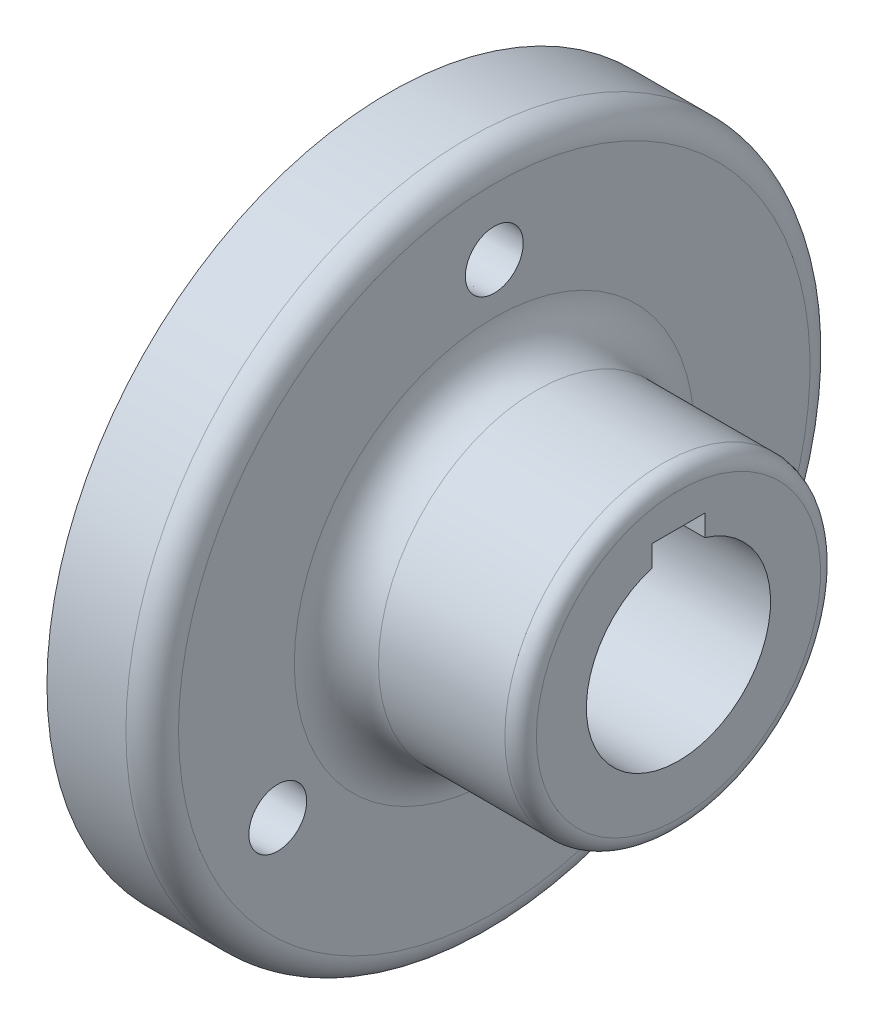
from build123d import *

# Parameters (mm, degrees)
SKETCH2_R          = 17.5
CUT_EXTRUDE1_DEPTH = 108.121426428
SKETCH3_W          = 10
SKETCH3_H          = 6.6
CUT_EXTRUDE2_DEPTH = 108.121426428
SKETCH4_R          = 4
CUT_EXTRUDE3_DEPTH = 10
SKETCH6_R          = 81.550028755
CUT_EXTRUDE6_DEPTH = 60


with BuildPart() as part:
    # Sketch1 → Revolve1 (revolve)
    with BuildSketch(Plane.XY, mode=Mode.PRIVATE) as revolve1_sk:
        with BuildLine():
            Line((-55, 0), (0, 0))
            Line((0, 0), (0, 65))
            Line((0, 65), (-15, 65))
            ThreePointArc((-15, 65), (-18.535533906, 63.535533906), (-20, 60))
            Line((-20, 60), (-20, 38))
            ThreePointArc((-20, 38), (-22.343145751, 32.343145751), (-28, 30))
            Line((-28, 30), (-52, 30))
            ThreePointArc((-52, 30), (-54.121320344, 29.121320344), (-55, 27))
            Line((-55, 27), (-55, 0))
        make_face()
    revolve(revolve1_sk.sketch.rotate(Axis((-55, 0, 0), (1, 0, 0)), 90), axis=Axis((-55, 0, 0), (1, 0, 0)))

    # Sketch2 → Cut-Extrude1 (cut, through all)
    with BuildSketch(Plane.ZY.offset(55)):
        Circle(SKETCH2_R)
    extrude(amount=-CUT_EXTRUDE1_DEPTH, mode=Mode.SUBTRACT)

    # Sketch3 → Cut-Extrude2 (cut, through all)
    with BuildSketch(Plane(origin=(0, 0, 0), x_dir=(0, 0, -1), z_dir=(1, 0, 0))):
        with Locations((0, 17.5)):
            Rectangle(SKETCH3_W, SKETCH3_H)
    extrude(amount=-CUT_EXTRUDE2_DEPTH, mode=Mode.SUBTRACT)

    # Sketch4 → Cut-Extrude3 (cut)
    with BuildSketch(Plane(origin=(0, -30, 0), x_dir=(-1, 0, 0), z_dir=(0, -1, 0))):
        with Locations(Location((40.229772479, 0, 0), (0, 0, 90))):
            Circle(SKETCH4_R)
    extrude(amount=-CUT_EXTRUDE3_DEPTH, mode=Mode.SUBTRACT)

    # Cut-Extrude5 cone 1 section (through the dimple's axis) → Cut-Extrude5 (revolve, cut)
    with BuildSketch(Plane(origin=(0, 47.5, 0), x_dir=(0, 0, -1), z_dir=(0, 1, 0))):
        Polygon((0, 0), (7, 0), (0, 93.336682434), align=None)
    revolve(axis=Axis((0, 47.5, 0), (-1, 0, 0)), mode=Mode.SUBTRACT)

    # Cut-Extrude5 cone 2 section (through the dimple's axis) → Cut-Extrude5 cone 2 (revolve, cut)
    with BuildSketch(Plane(origin=(0, -23.75, -41.13620668), x_dir=(0, 0, -1), z_dir=(0, 1, 0))):
        Polygon((0, 0), (7, 0), (0, 93.336682434), align=None)
    revolve(axis=Axis((0, -23.75, -41.13620668), (-1, 0, 0)), mode=Mode.SUBTRACT)

    # Cut-Extrude5 cone 3 section (through the dimple's axis) → Cut-Extrude5 cone 3 (revolve, cut)
    with BuildSketch(Plane(origin=(0, -23.75, 41.13620668), x_dir=(0, 0, -1), z_dir=(0, 1, 0))):
        Polygon((0, 0), (7, 0), (0, 93.336682434), align=None)
    revolve(axis=Axis((0, -23.75, 41.13620668), (-1, 0, 0)), mode=Mode.SUBTRACT)

    # Mirror1: part across plane


with BuildPart() as part_1:
    add(part.part)
    add(part.part.mirror(Plane.ZY))

    # Sketch6 → Cut-Extrude6 (cut)
    with BuildSketch(Plane(origin=(0, 0, 0), x_dir=(0, 0, -1), z_dir=(1, 0, 0))):
        Circle(SKETCH6_R)
    extrude(amount=-CUT_EXTRUDE6_DEPTH, mode=Mode.SUBTRACT)


solid = part_1.part
